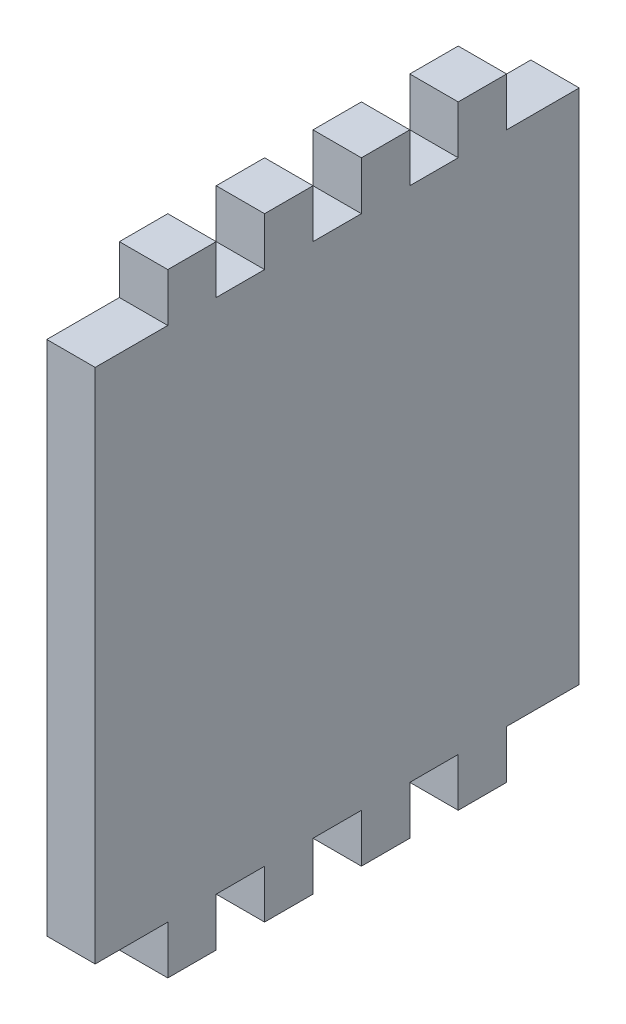
from build123d import *

# Parameters (mm, degrees)
SKETCH1_W           = 50.8
SKETCH1_H           = 54.22646
BOSS_EXTRUDE1_DEPTH = 5.08
SKETCH2_W           = 5.08
SKETCH2_H           = 5.08
BOSS_EXTRUDE2_DEPTH = 5.08


with BuildPart() as part:
    # Sketch1 → Boss-Extrude1 (new body)
    with BuildSketch(Plane(origin=(0, 0, 0), x_dir=(0, 0, -1), z_dir=(1, 0, 0))):
        with Locations((5.176303318, -13.02886981)):
            Rectangle(SKETCH1_W, SKETCH1_H)
    extrude(amount=BOSS_EXTRUDE1_DEPTH)

    # Sketch2 → Boss-Extrude2 (add)
    with BuildSketch(Plane(origin=(5.08, 0, 0), x_dir=(0, 0, -1), z_dir=(1, 0, 0))):
        with Locations((-10.063696682, 16.62436019)):
            Rectangle(SKETCH2_W, SKETCH2_H)
        with Locations((10.256303318, 16.62436019)):
            Rectangle(SKETCH2_W, SKETCH2_H)
        with Locations((20.416303318, 16.62436019)):
            Rectangle(SKETCH2_W, SKETCH2_H)
        with Locations((0.096303318, 16.62436019)):
            Rectangle(SKETCH2_W, SKETCH2_H)
        with Locations((0.096303318, -42.68209981)):
            Rectangle(SKETCH2_W, SKETCH2_H)
        with Locations((-10.063696682, -42.68209981)):
            Rectangle(SKETCH2_W, SKETCH2_H)
        with Locations((20.416303318, -42.68209981)):
            Rectangle(SKETCH2_W, SKETCH2_H)
        with Locations((10.256303318, -42.68209981)):
            Rectangle(SKETCH2_W, SKETCH2_H)
    extrude(amount=-BOSS_EXTRUDE2_DEPTH)


solid = part.part
